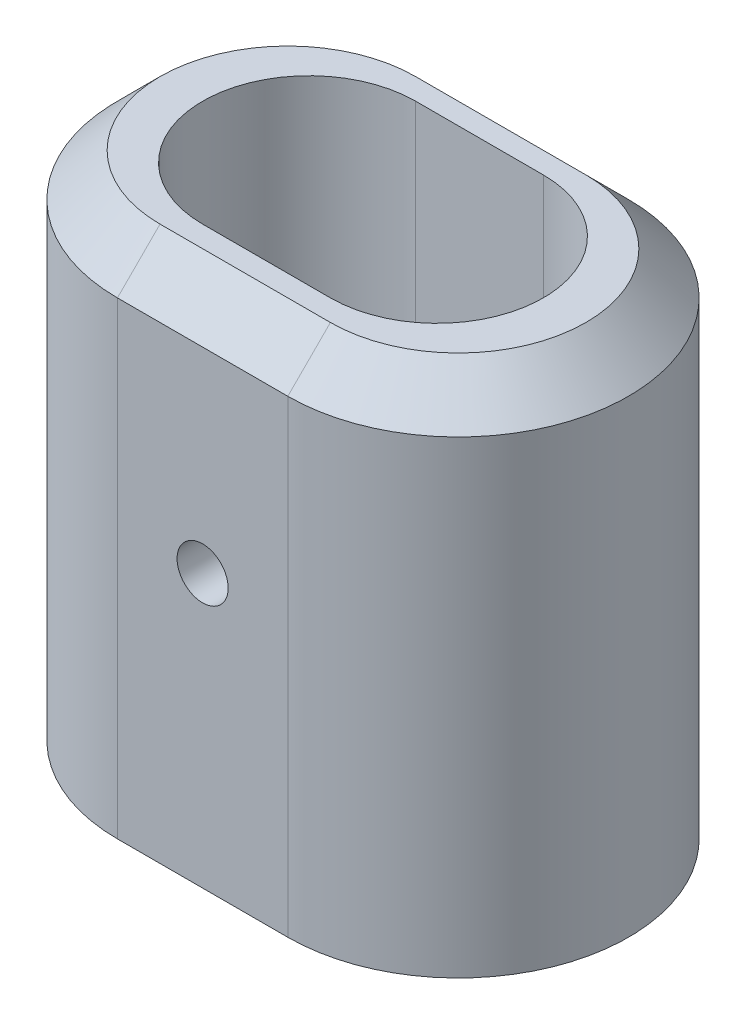
from build123d import *

# Parameters (mm, degrees)
SALIENTE_EXTRUIR1_DEPTH = 60
CHAFL_N2_SIZE           = 5
CROQUIS6_R              = 3
CORTAR_EXTRUIR1_DEPTH   = 40


with BuildPart() as part:
    # Croquis2 → Saliente-Extruir1 (new body)
    with BuildSketch(Plane(origin=(0, 0, 0), x_dir=(1, 0, 0), z_dir=(0, 1, 0))):
        with BuildLine():
            Line((-10, 20), (10, 20))
            ThreePointArc((10, 20), (30, 0), (10, -20))
            Line((10, -20), (-10, -20))
            ThreePointArc((-10, -20), (-30, 0), (-10, 20))
        make_face()
        with BuildLine():
            Line((-7.5, 12.5), (7.5, 12.5))
            ThreePointArc((7.5, 12.5), (20, 0), (7.5, -12.5))
            Line((7.5, -12.5), (-7.5, -12.5))
            ThreePointArc((-7.5, -12.5), (-20, 0), (-7.5, 12.5))
        make_face(mode=Mode.SUBTRACT)
    extrude(amount=SALIENTE_EXTRUIR1_DEPTH)

    # Chaflán2
    chafl_n2_edges = [part.edges().sort_by_distance(p)[0] for p in [
        (30, 60, 0),
        (0, 60, -20),
        (-30, 60, 0),
        (0, 60, 20),
    ]]
    chamfer(chafl_n2_edges, length=CHAFL_N2_SIZE)

    # Croquis6 → Cortar-Extruir1 (cut)
    with BuildSketch(Plane.XY.offset(20)):
        with Locations((0, 32)):
            Circle(CROQUIS6_R)
    extrude(amount=-CORTAR_EXTRUIR1_DEPTH, mode=Mode.SUBTRACT)


solid = part.part
